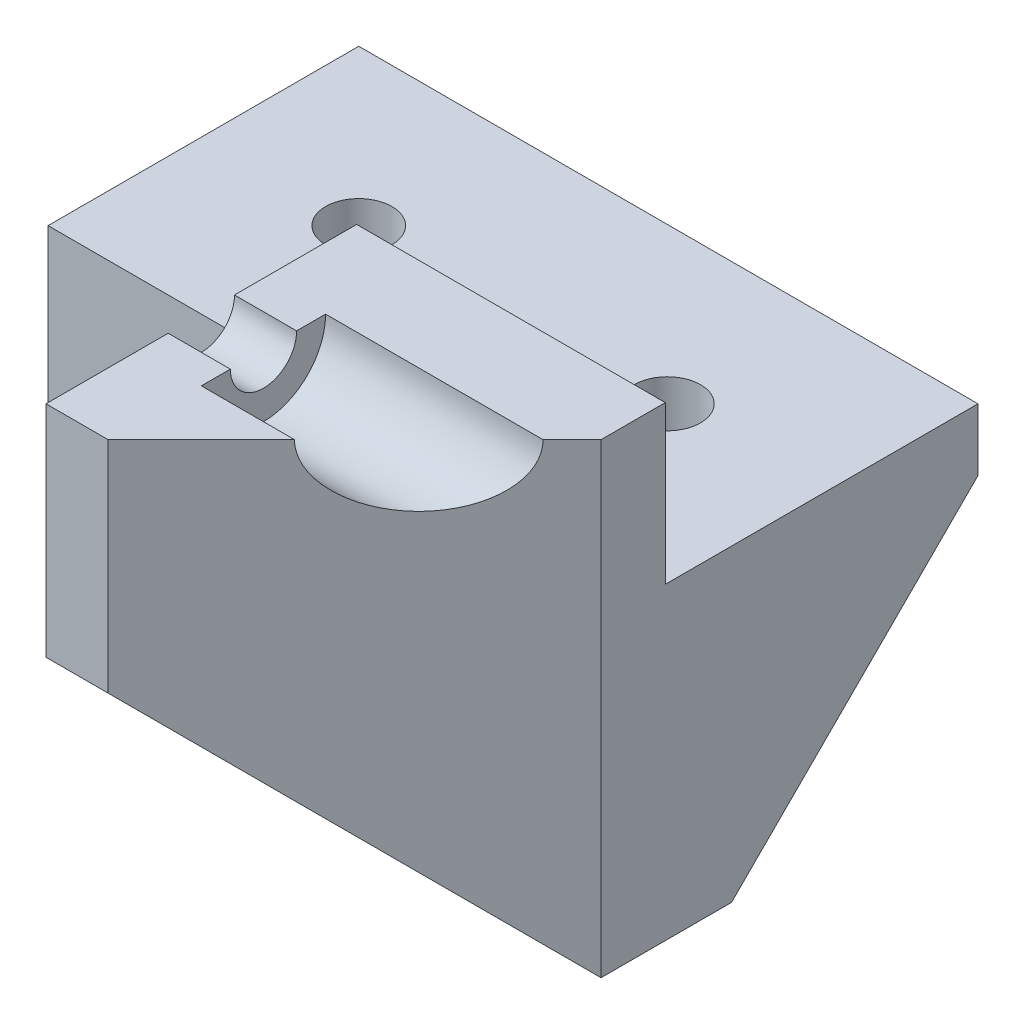
from build123d import *

# Parameters (mm, degrees)
BOSS_EXTRUDE1_DEPTH = 29.8
BOSS_EXTRUDE2_DEPTH = 30
SKETCH2_R           = 3.2
CUT_EXTRUDE1_DEPTH  = 62.943845538
CUT_EXTRUDE2_START  = -21.2
SKETCH2_3_R         = 6
SKETCH2_3_R_2       = 3.2
CUT_EXTRUDE2_DEPTH  = 41.743845538
CUT_EXTRUDE3_START  = 6
CUT_EXTRUDE3_DEPTH  = 56.943845538


with BuildPart() as part:
    # Sketch1 → Boss-Extrude1 (new body)
    with BuildSketch(Plane.YZ):
        with BuildLine():
            Line((-15.2, 0), (0, 0))
            Line((0, 0), (0, 11.8))
            ThreePointArc((0, 11.8), (-3.2, 15), (0, 18.2))
            Line((0, 18.2), (0, 30))
            Line((0, 30), (-21.2, 30))
            Line((-21.2, 30), (-45, 6.2))
            Line((-45, 6.2), (-45, -6.4))
            Line((-45, -6.4), (-21.2, -30.2))
            Line((-21.2, -30.2), (-15.2, -30.2))
            Line((-15.2, -30.2), (-15.2, 0))
        make_face()
    extrude(amount=BOSS_EXTRUDE1_DEPTH)

    # Sketch1<3> → Boss-Extrude2 (add)
    with BuildSketch(Plane.YZ):
        Polygon((-15.2, -30.2), (-15.2, -0.2), (-45, -0.2), (-45, -6.4), (-21.2, -30.2), align=None)
    extrude(amount=-BOSS_EXTRUDE2_DEPTH)

    # Sketch2 → Cut-Extrude1 (cut, through all)
    with BuildSketch(Plane(origin=(0, 0, 0), x_dir=(-1, 0, 0), z_dir=(0, 1, 0))):
        Polygon((-29.8, 18.2), (-17.8, 18.2), (-6, 30), (-29.8, 30), align=None)
        Polygon((-29.8, 11.8), (-24.2, 11.8), (-17.8, 18.2), (-29.8, 18.2), align=None)
        Polygon((-29.8, 11.8), (-29.8, 6.2), (-24.2, 11.8), align=None)
        with Locations(Location((-14.8, -15.2, 0), (0, 0, 90))):
            Circle(SKETCH2_R)
        with Locations(Location((15, -15.2, 0), (0, 0, 90))):
            Circle(SKETCH2_R)
    extrude(amount=-CUT_EXTRUDE1_DEPTH, mode=Mode.SUBTRACT)

    # Sketch2<3> → Cut-Extrude2 (cut, through all)
    # profile 1 of 2: a face of its own
    with BuildSketch(Plane(origin=(0, 0, 0), x_dir=(-1, 0, 0), z_dir=(0, 1, 0)).offset(CUT_EXTRUDE2_START)):
        with Locations(Location((-14.8, -15.2, 0), (0, 0, 90))):
            Circle(SKETCH2_3_R)
        with Locations(Location((-14.8, -15.2, 0), (0, 0, 90))):
            Circle(SKETCH2_3_R_2, mode=Mode.SUBTRACT)
    # profile 2 of 2: a face of its own
    with BuildSketch(Plane(origin=(0, 0, 0), x_dir=(-1, 0, 0), z_dir=(0, 1, 0)).offset(CUT_EXTRUDE2_START)):
        with Locations(Location((15, -15.2, 0), (0, 0, 90))):
            Circle(SKETCH2_3_R)
        with Locations(Location((15, -15.2, 0), (0, 0, 90))):
            Circle(SKETCH2_3_R_2, mode=Mode.SUBTRACT)
    extrude(amount=-CUT_EXTRUDE2_DEPTH, mode=Mode.SUBTRACT)

    # Sketch1<4> → Cut-Extrude3 (cut, through all)
    with BuildSketch(Plane.YZ.offset(CUT_EXTRUDE3_START)):
        with BuildLine():
            ThreePointArc((0, 21), (-6, 15), (0, 9))
            Line((0, 9), (0, 11.8))
            ThreePointArc((0, 11.8), (-3.2, 15), (0, 18.2))
            Line((0, 18.2), (0, 21))
        make_face()
        with BuildLine():
            Line((0, 11.8), (0, 9))
            ThreePointArc((0, 9), (4.242640687, 10.757359313), (6, 15))
            ThreePointArc((6, 15), (4.242640687, 19.242640687), (0, 21))
            Line((0, 21), (0, 18.2))
            ThreePointArc((0, 18.2), (2.2627417, 17.2627417), (3.2, 15))
            ThreePointArc((3.2, 15), (2.2627417, 12.7372583), (0, 11.8))
        make_face()
    extrude(amount=CUT_EXTRUDE3_DEPTH, mode=Mode.SUBTRACT)


solid = part.part
